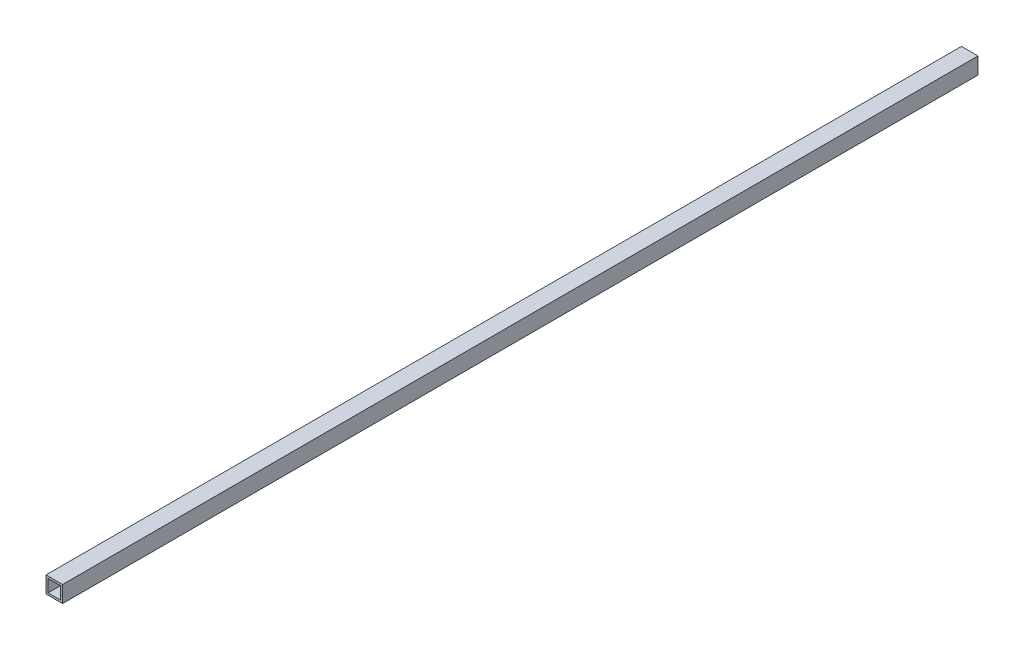
from build123d import *

# Parameters (mm, degrees)
SKETCH1_W           = 12.7
SKETCH1_H           = 12.7
SKETCH1_W_2         = 9.525
SKETCH1_H_2         = 9.525
BOSS_EXTRUDE1_DEPTH = 350.8375


with BuildPart() as part:
    # Sketch1 → Boss-Extrude1 (new, symmetric)
    with BuildSketch(Plane.XY):
        Rectangle(SKETCH1_W, SKETCH1_H)
        Rectangle(SKETCH1_W_2, SKETCH1_H_2, mode=Mode.SUBTRACT)
    extrude(amount=BOSS_EXTRUDE1_DEPTH, both=True)


solid = part.part
